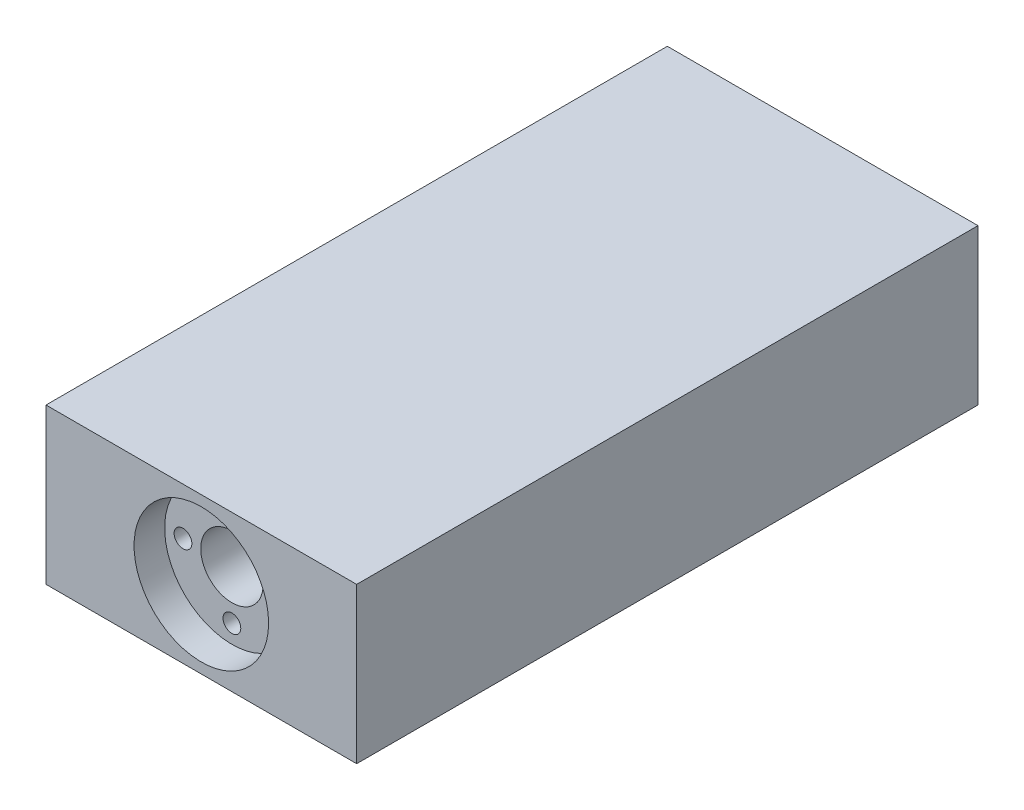
from build123d import *

# Parameters (mm, degrees)
SKETCH1_W                  = 50.8
SKETCH1_H                  = 25.4
BASE_DEPTH                 = 101.6
SKETCH2_R                  = 10.999999971
LEADNUT_FLANGE_INSET_DEPTH = 4.999999906
SKETCH3_R                  = 5.09999996
LEADNUT_THROUGH_HOLE_DEPTH = 113.059627066
LEADNUT_HOLE_PATTERN_D     = 2.9
LEADNUT_HOLE_PATTERN_DEPTH = 10.0000054
LEADNUT_HOLE_PATTERN_TIP   = 0.871247898


with BuildPart() as part:
    # Sketch1 → base (new body)
    with BuildSketch(Plane.XY):
        with Locations((25.4, 12.7)):
            Rectangle(SKETCH1_W, SKETCH1_H)
    extrude(amount=BASE_DEPTH)

    # Sketch2 → leadnut_flange_inset (cut)
    with BuildSketch(Plane.XY.offset(101.6)):
        with Locations((25.4, 12.7)):
            Circle(SKETCH2_R)
    extrude(amount=-LEADNUT_FLANGE_INSET_DEPTH, mode=Mode.SUBTRACT)

    # Sketch3 → leadnut_through_hole (cut, through all)
    with BuildSketch(Plane.XY.offset(96.600000094)):
        with Locations((25.4, 12.7)):
            Circle(SKETCH3_R)
    extrude(amount=-LEADNUT_THROUGH_HOLE_DEPTH, mode=Mode.SUBTRACT)

    # leadnut_hole_pattern
    with Locations(Plane.XY.offset(96.600000094)):
        with Locations((25.4, 12.7), (25.4, 20.6999967), (17.4000033, 12.7), (25.4, 4.7000033), (33.3999967, 12.7)):
            Hole(LEADNUT_HOLE_PATTERN_D / 2, depth=LEADNUT_HOLE_PATTERN_DEPTH)
            with Locations((0, 0, -(LEADNUT_HOLE_PATTERN_DEPTH + LEADNUT_HOLE_PATTERN_TIP / 2))):  # 118° drill point
                Cone(0, LEADNUT_HOLE_PATTERN_D / 2, LEADNUT_HOLE_PATTERN_TIP, mode=Mode.SUBTRACT)


solid = part.part
